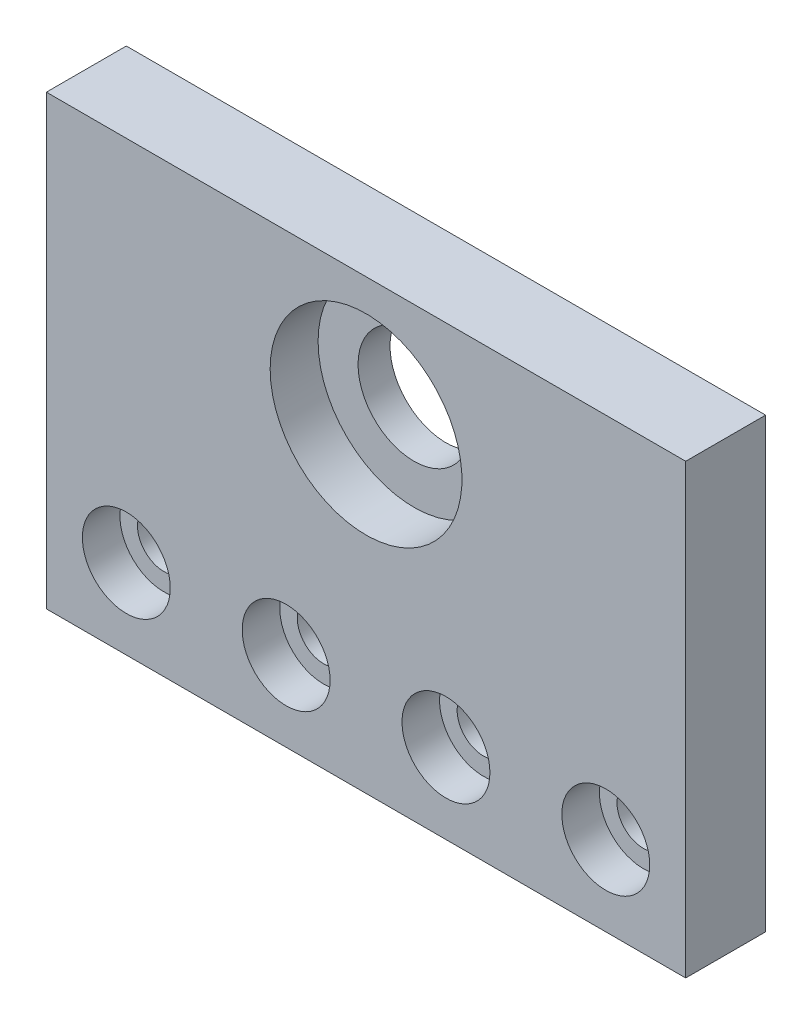
from build123d import *

# Parameters (mm, degrees)
SKETCH_1_W                   = 80
SKETCH_1_H                   = 56
EXTRUDE_1_DEPTH              = 10
HOLE_WIZARD_M6_1_D           = 6.6
HOLE_WIZARD_M6_1_CBORE_D     = 11
HOLE_WIZARD_M6_1_CBORE_DEPTH = 4.7
SKETCH_5_R                   = 7
CUT_EXTRUDE_1_DEPTH          = 10
SKETCH_6_R                   = 12
CUT_EXTRUDE_2_DEPTH          = 6
SKETCH_7_R                   = 5
CUT_EXTRUDE_3_DEPTH          = 5


with BuildPart() as part:
    # 草图1 → 凸台-拉伸1 (new body)
    with BuildSketch(Plane.XY):
        with Locations((0, -12)):
            Rectangle(SKETCH_1_W, SKETCH_1_H)
    extrude(amount=-EXTRUDE_1_DEPTH)

    # M6 内六角花型圆柱头螺钉的柱形沉头孔1 (through all)
    with Locations(Plane.XY):
        with Locations((30, -30), (-30, -30), (10, -30), (-10, -30)):
            CounterBoreHole(HOLE_WIZARD_M6_1_D / 2, HOLE_WIZARD_M6_1_CBORE_D / 2, HOLE_WIZARD_M6_1_CBORE_DEPTH)

    # 草图5 → 切除-拉伸1 (cut)
    with BuildSketch(Plane.XY):
        Circle(SKETCH_5_R)
    extrude(amount=-CUT_EXTRUDE_1_DEPTH, mode=Mode.SUBTRACT)

    # 草图6 → 切除-拉伸2 (cut)
    with BuildSketch(Plane(origin=(0, 0, 0), x_dir=(-1, 0, 0), z_dir=(0, 0, -1))):
        Circle(SKETCH_6_R)
    extrude(amount=CUT_EXTRUDE_2_DEPTH, mode=Mode.SUBTRACT)

    # 草图7 → 切除-拉伸3 (cut)
    with BuildSketch(Plane(origin=(0, 0, -10), x_dir=(-1, 0, 0), z_dir=(0, 0, -1))):
        with Locations((30, 0)):
            Circle(SKETCH_7_R)
    cut_extrude_3 = extrude(amount=-CUT_EXTRUDE_3_DEPTH, mode=Mode.SUBTRACT)

    # 镜向1: 切除-拉伸3 across plane
    add(cut_extrude_3.mirror(Plane(origin=(0, 0, 0), x_dir=(0, 0, 1), z_dir=(1, 0, 0))), mode=Mode.SUBTRACT)


solid = part.part
